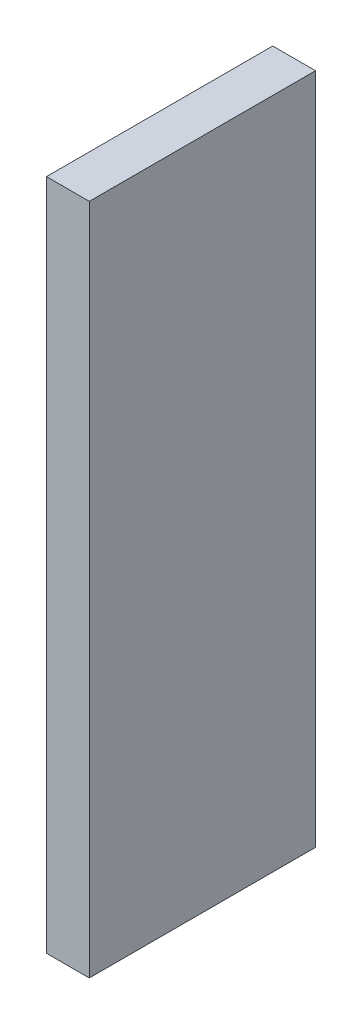
from build123d import *

# Parameters (mm, degrees)
SKETCH1_W           = 2.8
SKETCH1_H           = 44
BOSS_EXTRUDE1_DEPTH = 14.8


with BuildPart() as part:
    # Sketch1 → Boss-Extrude1 (new body)
    with BuildSketch(Plane.XY):
        with Locations((1.4, 22)):
            Rectangle(SKETCH1_W, SKETCH1_H)
    extrude(amount=BOSS_EXTRUDE1_DEPTH)


solid = part.part
